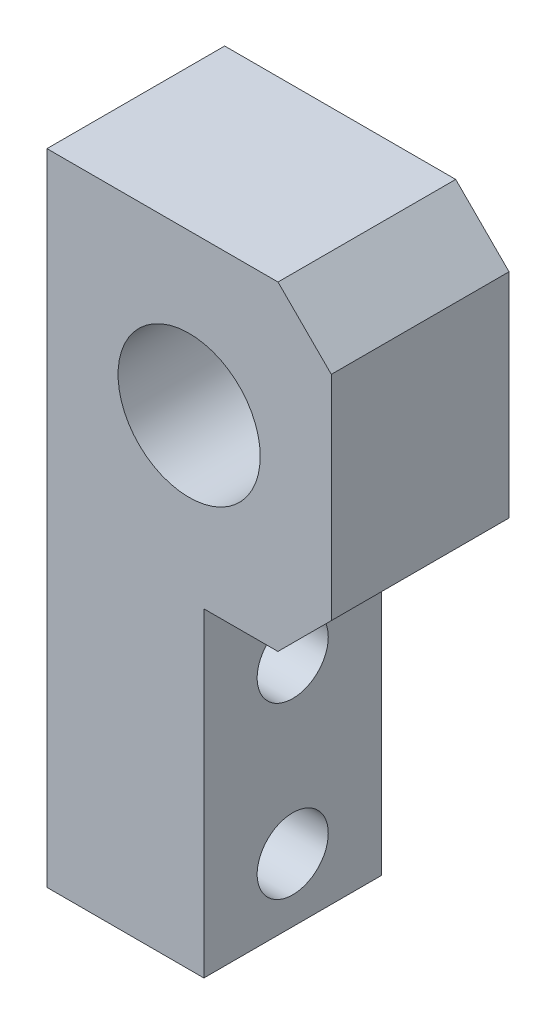
from build123d import *
from OCP.BRepFilletAPI import BRepFilletAPI_MakeChamfer

# Parameters (mm, degrees)
SKETCH_1_W            = 10
SKETCH_1_H            = 36
EXTRUDE_1_DEPTH       = 16
SKETCH_5_R            = 4.000000001
CUT_EXTRUDE_2_DEPTH   = 62.591736841
CUT_EXTRUDE_3_DEPTH   = 62.591736841
CHAMFER_1_SIZE        = 3
CHAMFER_1_SIZE2       = 3.003831905
SKETCH_7_R            = 2
CUT_EXTRUDE_2_2_DEPTH = 63.573848038


with BuildPart() as part:
    # Эскиз1 → Вытянуть1 (new body)
    with BuildSketch(Plane(origin=(0, 0, 0), x_dir=(0, 0, -1), z_dir=(1, 0, 0))):
        with Locations((-15, -40.630555576)):
            Rectangle(SKETCH_1_W, SKETCH_1_H)
    extrude(amount=EXTRUDE_1_DEPTH)

    # Эскиз5 → Cut-Extrude 2 (cut, through all)
    with BuildSketch(Plane.XY.offset(20)):
        with Locations((8, -31.630555576)):
            Circle(SKETCH_5_R)
    extrude(amount=-CUT_EXTRUDE_2_DEPTH, mode=Mode.SUBTRACT)

    # Эскиз6 → Вырез-Вытянуть3 (cut, through all)
    with BuildSketch(Plane.XY.offset(20)):
        Polygon((16, -40.630555576), (16, -58.630555576), (8.828613207, -58.630555576), (8.828613207, -40.639698094), align=None)
    extrude(amount=-CUT_EXTRUDE_3_DEPTH, mode=Mode.SUBTRACT)

    # Фаска1: one chamfer whose edges measure the first distance from different faces: ONE call of the kernel's chamfer builder (chamfer() names one face for all edges)
    chamfer_1_edges_1 = [part.edges().sort_by_distance(p)[0] for p in [
        (16, -40.630555576, 15),
    ]]
    chamfer_1_side_1 = [part.faces().sort_by_distance(p)[0] for p in [
        (16, -31.630555576, 15),
    ]]
    chamfer_1_edges_2 = [part.edges().sort_by_distance(p)[0] for p in [
        (16, -22.630555576, 15),
    ]]
    chamfer_1 = BRepFilletAPI_MakeChamfer(part.part.solid().wrapped)
    for e in chamfer_1_edges_1:
        chamfer_1.Add(CHAMFER_1_SIZE, CHAMFER_1_SIZE2, e.wrapped, chamfer_1_side_1[0].wrapped)  # the first distance lies on this face
    for e in chamfer_1_edges_2:
        chamfer_1.Add(CHAMFER_1_SIZE, e.wrapped)
    add(Compound.cast(chamfer_1.Shape()), mode=Mode.REPLACE)

    # Эскиз7 → Cut-Extrude 2 2 (cut, through all)
    with BuildSketch(Plane(origin=(8.828613207, 0, 0), x_dir=(0, 0, -1), z_dir=(1, 0, 0))):
        with Locations((-15, -55.075818026)):
            Circle(SKETCH_7_R)
        with Locations((-15, -45.513282345)):
            Circle(SKETCH_7_R)
    extrude(amount=-CUT_EXTRUDE_2_2_DEPTH, mode=Mode.SUBTRACT)


solid = part.part
